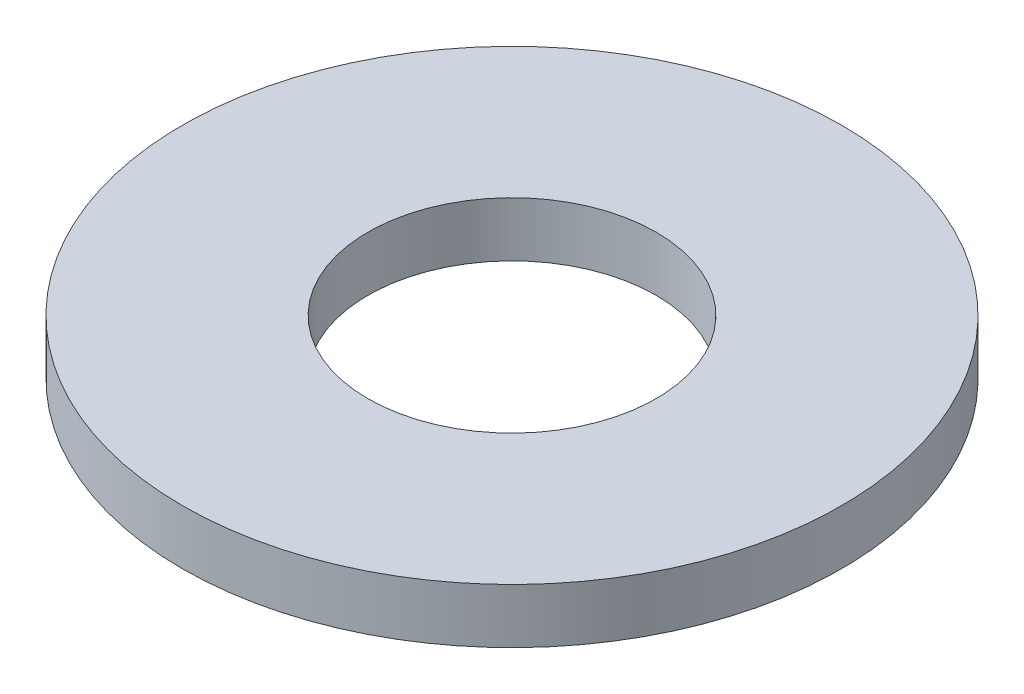
from build123d import *

# Parameters (mm, degrees)
SKETCH1_R           = 12.7
SKETCH1_R_2         = 5.55625
BOSS_EXTRUDE1_DEPTH = 2.1082


with BuildPart() as part:
    # Sketch1 → Boss-Extrude1 (new body)
    with BuildSketch(Plane(origin=(0, 0, 0), x_dir=(1, 0, 0), z_dir=(0, 1, 0))):
        with Locations(Location((0, 0, 0), (0, 0, 270))):
            Circle(SKETCH1_R)
        with Locations(Location((0, 0, 0), (0, 0, 270))):
            Circle(SKETCH1_R_2, mode=Mode.SUBTRACT)
    extrude(amount=BOSS_EXTRUDE1_DEPTH)


solid = part.part
